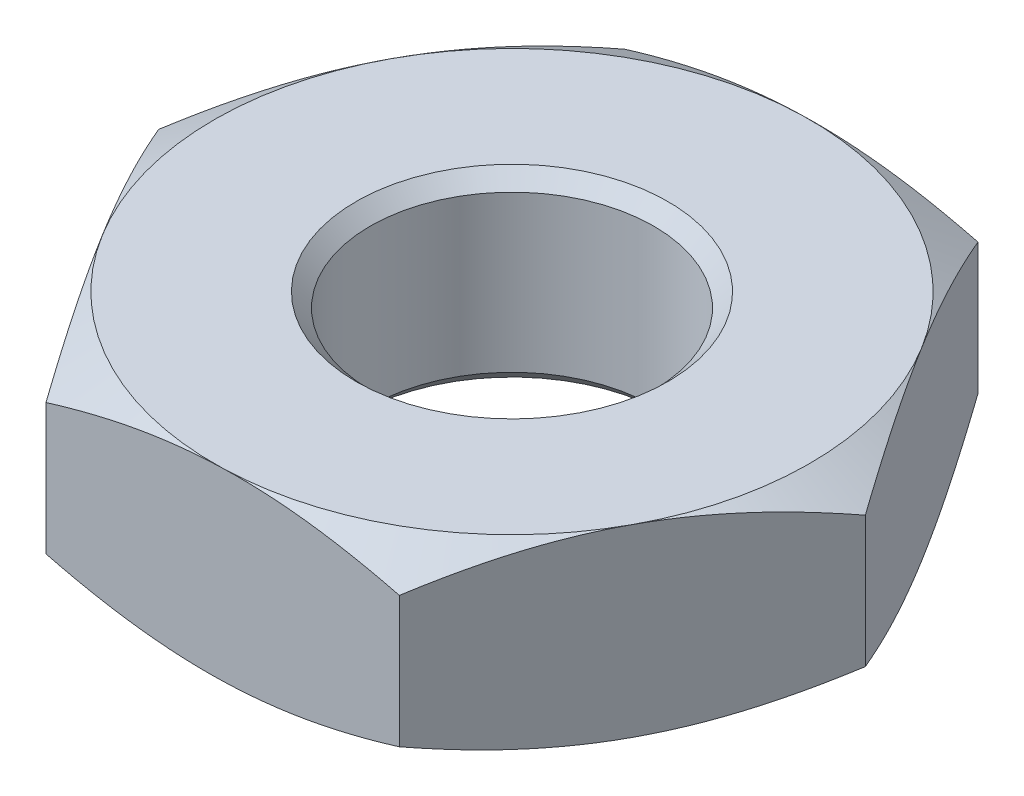
from build123d import *

# Parameters (mm, degrees)
SKETCH1_R           = 1
BOSS_EXTRUDE1_DEPTH = 1.3
SKETCH2_OUTSIDE_W   = 624.082
SKETCH2_OUTSIDE_H   = 623.5
SKETCH2_OUTSIDE_R   = 2.1
CUT_EXTRUDE1_DEPTH  = 177.8
CUT_EXTRUDE1_DRAFT  = -60
SKETCH3_OUTSIDE_W   = 624.082
SKETCH3_OUTSIDE_H   = 623.5
SKETCH3_OUTSIDE_R   = 2.1
CUT_EXTRUDE2_DEPTH  = 177.8
CUT_EXTRUDE2_DRAFT  = -60
CHAMFER1_SIZE       = 0.1
CHAMFER2_SIZE       = 0.1


with BuildPart() as part:
    # Sketch1 → Boss-Extrude1 (new body)
    with BuildSketch(Plane(origin=(0, 0, 0), x_dir=(1, 0, 0), z_dir=(0, 1, 0))):
        Polygon((1.153206949, 2.13309956), (-1.270714933, 2.065256294), (-2.423921882, -0.067843266), (-1.153206949, -2.13309956), (1.270714933, -2.065256294), (2.423921882, 0.067843266), align=None)
        with Locations(Location((0, 0, 0), (0, 0, 270))):
            Circle(SKETCH1_R, mode=Mode.SUBTRACT)
    extrude(amount=BOSS_EXTRUDE1_DEPTH)


with BuildPart() as cut_extrude1_tool:
    # Sketch2 outside → Cut-Extrude1 (with draft: the straight prism first)
    with BuildSketch(Plane(origin=(0, 1.3, 0), x_dir=(1, 0, 0), z_dir=(0, 1, 0))):
        Rectangle(SKETCH2_OUTSIDE_W, SKETCH2_OUTSIDE_H)
        Circle(SKETCH2_OUTSIDE_R, mode=Mode.SUBTRACT)
    extrude(amount=-CUT_EXTRUDE1_DEPTH)
    # Cut-Extrude1: the draft: its side faces are tilted about the plane it starts from
    cut_extrude1_sides = [cut_extrude1_tool.faces().sort_by_distance(p)[0] for p in [
        (0, -87.6, 311.75),
        (312.041, -87.6, 0),
        (0, -87.6, -311.75),
        (-312.041, -87.6, 0),
        (-2.1, -87.6, 0),
    ]]
    draft(cut_extrude1_sides, Plane(origin=(0, 1.3, 0), x_dir=(1, 0, 0), z_dir=(0, 1, 0)), CUT_EXTRUDE1_DRAFT)


with BuildPart() as part_1:
    add(part.part)

    # Cut-Extrude1: cut by cut_extrude1_tool
    add(cut_extrude1_tool.part, mode=Mode.SUBTRACT)


with BuildPart() as cut_extrude2_tool:
    # Sketch3 outside → Cut-Extrude2 (with draft: the straight prism first)
    with BuildSketch(Plane.XZ):
        Rectangle(SKETCH3_OUTSIDE_W, SKETCH3_OUTSIDE_H)
        Circle(SKETCH3_OUTSIDE_R, mode=Mode.SUBTRACT)
    extrude(amount=-CUT_EXTRUDE2_DEPTH)
    # Cut-Extrude2: the draft: its side faces are tilted about the plane it starts from
    cut_extrude2_sides = [cut_extrude2_tool.faces().sort_by_distance(p)[0] for p in [
        (0, 88.9, -311.75),
        (312.041, 88.9, 0),
        (0, 88.9, 311.75),
        (-312.041, 88.9, 0),
        (-2.1, 88.9, 0),
    ]]
    draft(cut_extrude2_sides, Plane.XZ, CUT_EXTRUDE2_DRAFT)


with BuildPart() as part_2:
    add(part_1.part)

    # Cut-Extrude2: cut by cut_extrude2_tool
    add(cut_extrude2_tool.part, mode=Mode.SUBTRACT)

    # Chamfer1
    chamfer1_edges = [part_2.edges().sort_by_distance(p)[0] for p in [
        (0, 1.3, -1),
    ]]
    chamfer(chamfer1_edges, length=CHAMFER1_SIZE)

    # Chamfer2
    chamfer2_edges = [part_2.edges().sort_by_distance(p)[0] for p in [
        (0, 0, -1),
    ]]
    chamfer(chamfer2_edges, length=CHAMFER2_SIZE)


solid = part_2.part
